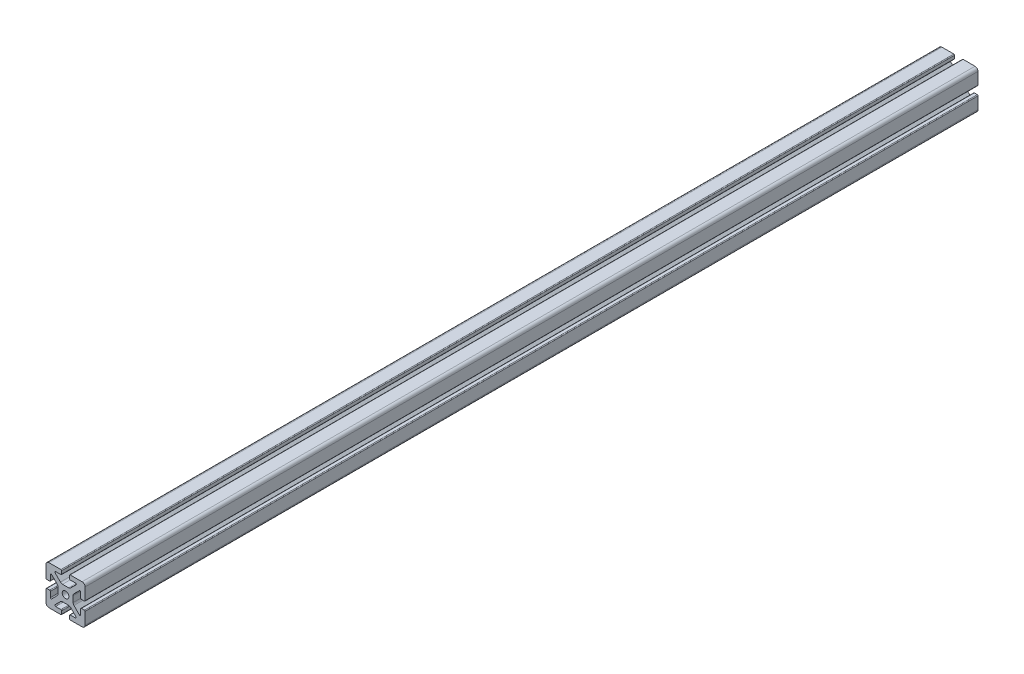
from build123d import *

# Parameters (mm, degrees)
SKETCH1_R           = 3.4036
BOSS_EXTRUDE1_DEPTH = 457.2


with BuildPart() as part:
    # Sketch1 → Boss-Extrude1 (new, symmetric)
    with BuildSketch(Plane.XY):
        with BuildLine():
            Line((-20, 16.952), (-20, 4.7625))
            ThreePointArc((-20, 4.7625), (-19.776815367, 4.223684633), (-19.238, 4.0005))
            Line((-19.238, 4.0005), (-16.2662, 4.0005))
            ThreePointArc((-16.2662, 4.0005), (-15.727384633, 4.223684633), (-15.5042, 4.7625))
            Line((-15.5042, 4.7625), (-15.5042, 10.2235))
            ThreePointArc((-15.5042, 10.2235), (-15.033804775, 10.927496204), (-14.203384633, 10.762315367))
            Line((-14.203384633, 10.762315367), (-8.635059555, 5.19399029))
            ThreePointArc((-8.635059555, 5.19399029), (-7.985348265, 4.221628629), (-7.7572, 3.074649845))
            Line((-7.7572, 3.074649845), (-7.7572, -3.074649845))
            ThreePointArc((-7.7572, -3.074649845), (-7.985348265, -4.221628629), (-8.635059555, -5.19399029))
            Line((-8.635059555, -5.19399029), (-14.203384633, -10.762315367))
            ThreePointArc((-14.203384633, -10.762315367), (-15.033804775, -10.927496204), (-15.5042, -10.2235))
            Line((-15.5042, -10.2235), (-15.5042, -4.7625))
            ThreePointArc((-15.5042, -4.7625), (-15.727384633, -4.223684633), (-16.2662, -4.0005))
            Line((-16.2662, -4.0005), (-19.238, -4.0005))
            ThreePointArc((-19.238, -4.0005), (-19.776815367, -4.223684633), (-20, -4.7625))
            Line((-20, -4.7625), (-20, -16.952))
            ThreePointArc((-20, -16.952), (-19.107261469, -19.107261469), (-16.952, -20))
            Line((-16.952, -20), (-4.7625, -20))
            ThreePointArc((-4.7625, -20), (-4.223684633, -19.776815367), (-4.0005, -19.238))
            Line((-4.0005, -19.238), (-4.0005, -16.2662))
            ThreePointArc((-4.0005, -16.2662), (-4.223684633, -15.727384633), (-4.7625, -15.5042))
            Line((-4.7625, -15.5042), (-10.2235, -15.5042))
            ThreePointArc((-10.2235, -15.5042), (-10.927496204, -15.033804775), (-10.762315367, -14.203384633))
            Line((-10.762315367, -14.203384633), (-5.19399029, -8.635059555))
            ThreePointArc((-5.19399029, -8.635059555), (-4.221628629, -7.985348265), (-3.074649845, -7.7572))
            Line((-3.074649845, -7.7572), (3.074649845, -7.7572))
            ThreePointArc((3.074649845, -7.7572), (4.221628629, -7.985348265), (5.19399029, -8.635059555))
            Line((5.19399029, -8.635059555), (10.762315367, -14.203384633))
            ThreePointArc((10.762315367, -14.203384633), (10.927496204, -15.033804775), (10.2235, -15.5042))
            Line((10.2235, -15.5042), (4.7625, -15.5042))
            ThreePointArc((4.7625, -15.5042), (4.223684633, -15.727384633), (4.0005, -16.2662))
            Line((4.0005, -16.2662), (4.0005, -19.238))
            ThreePointArc((4.0005, -19.238), (4.223684633, -19.776815367), (4.7625, -20))
            Line((4.7625, -20), (16.952, -20))
            ThreePointArc((16.952, -20), (19.107261469, -19.107261469), (20, -16.952))
            Line((20, -16.952), (20, -4.7625))
            ThreePointArc((20, -4.7625), (19.776815367, -4.223684633), (19.238, -4.0005))
            Line((19.238, -4.0005), (16.2662, -4.0005))
            ThreePointArc((16.2662, -4.0005), (15.727384633, -4.223684633), (15.5042, -4.7625))
            Line((15.5042, -4.7625), (15.5042, -10.2235))
            ThreePointArc((15.5042, -10.2235), (15.033804775, -10.927496204), (14.203384633, -10.762315367))
            Line((14.203384633, -10.762315367), (8.635059555, -5.19399029))
            ThreePointArc((8.635059555, -5.19399029), (7.985348265, -4.221628629), (7.7572, -3.074649845))
            Line((7.7572, -3.074649845), (7.7572, 3.074649845))
            ThreePointArc((7.7572, 3.074649845), (7.985348265, 4.221628629), (8.635059555, 5.19399029))
            Line((8.635059555, 5.19399029), (14.203384633, 10.762315367))
            ThreePointArc((14.203384633, 10.762315367), (15.033804775, 10.927496204), (15.5042, 10.2235))
            Line((15.5042, 10.2235), (15.5042, 4.7625))
            ThreePointArc((15.5042, 4.7625), (15.727384633, 4.223684633), (16.2662, 4.0005))
            Line((16.2662, 4.0005), (19.238, 4.0005))
            ThreePointArc((19.238, 4.0005), (19.776815367, 4.223684633), (20, 4.7625))
            Line((20, 4.7625), (20, 16.952))
            ThreePointArc((20, 16.952), (19.107261469, 19.107261469), (16.952, 20))
            Line((16.952, 20), (4.7625, 20))
            ThreePointArc((4.7625, 20), (4.223684633, 19.776815367), (4.0005, 19.238))
            Line((4.0005, 19.238), (4.0005, 16.2662))
            ThreePointArc((4.0005, 16.2662), (4.223684633, 15.727384633), (4.7625, 15.5042))
            Line((4.7625, 15.5042), (10.2235, 15.5042))
            ThreePointArc((10.2235, 15.5042), (10.927496204, 15.033804775), (10.762315367, 14.203384633))
            Line((10.762315367, 14.203384633), (5.19399029, 8.635059555))
            ThreePointArc((5.19399029, 8.635059555), (4.221628629, 7.985348265), (3.074649845, 7.7572))
            Line((3.074649845, 7.7572), (-3.074649845, 7.7572))
            ThreePointArc((-3.074649845, 7.7572), (-4.221628629, 7.985348265), (-5.19399029, 8.635059555))
            Line((-5.19399029, 8.635059555), (-10.762315367, 14.203384633))
            ThreePointArc((-10.762315367, 14.203384633), (-10.927496204, 15.033804775), (-10.2235, 15.5042))
            Line((-10.2235, 15.5042), (-4.7625, 15.5042))
            ThreePointArc((-4.7625, 15.5042), (-4.223684633, 15.727384633), (-4.0005, 16.2662))
            Line((-4.0005, 16.2662), (-4.0005, 19.238))
            ThreePointArc((-4.0005, 19.238), (-4.223684633, 19.776815367), (-4.7625, 20))
            Line((-4.7625, 20), (-16.952, 20))
            ThreePointArc((-16.952, 20), (-19.107261469, 19.107261469), (-20, 16.952))
        make_face()
        with Locations(Location((0, 0, 0), (0, 0, 180))):
            Circle(SKETCH1_R, mode=Mode.SUBTRACT)
    extrude(amount=BOSS_EXTRUDE1_DEPTH, both=True)


solid = part.part
